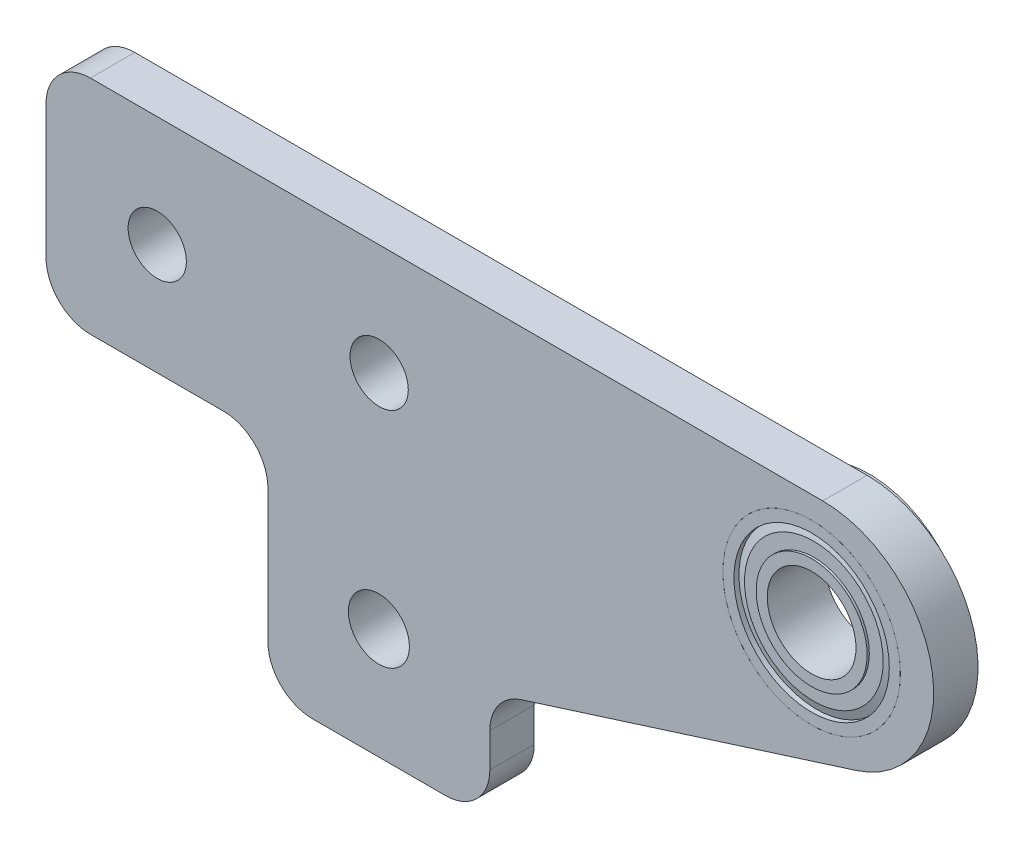
from build123d import *

# Parameters (mm, degrees)
SKETCH1_R           = 10
SKETCH1_R_2         = 8
BOSS_EXTRUDE1_DEPTH = 2
SKETCH2_R           = 2.75
SKETCH2_R_2         = 2.625
CUT_EXTRUDE1_DEPTH  = 76.345869163
FILLET1_R           = 4
SKETCH3_R           = 9
BOSS_EXTRUDE2_DEPTH = 1.2
SKETCH4_R           = 8
BOSS_EXTRUDE3_DEPTH = 4
SKETCH5_R           = 4
CUT_EXTRUDE2_DEPTH  = 76.419095725
SKETCH5_3_R         = 7
SKETCH5_3_R_2       = 5
CUT_EXTRUDE3_DEPTH  = 0.2


with BuildPart() as part:
    # Sketch1 → Boss-Extrude1 (new, symmetric)
    # profile 1 of 2: a face of its own
    with BuildSketch(Plane.XY):
        with BuildLine():
            ThreePointArc((4.021694793, -9.532542189), (-8.882444583, -1.528819498), (1, 10))
            Line((1, 10), (-69, 10))
            Line((-69, 10), (-69, -10))
            Line((-69, -10), (-49, -10))
            Line((-49, -10), (-49, -30))
            Line((-49, -30), (-29, -30))
            Line((-29, -30), (-29, -20))
            Line((-29, -20), (4.021694793, -9.532542189))
        make_face()
    # profile 2 of 2: a face of its own
    with BuildSketch(Plane.XY):
        with Locations((1, 0)):
            Circle(SKETCH1_R)
        Circle(SKETCH1_R_2, mode=Mode.SUBTRACT)
    extrude(amount=BOSS_EXTRUDE1_DEPTH, both=True)

    # Sketch2 → Cut-Extrude1 (cut, through all)
    with BuildSketch(Plane.XY.offset(2)):
        with Locations((-39, -20)):
            Circle(SKETCH2_R)
        with Locations((-58.975, 0)):
            Circle(SKETCH2_R_2)
        with Locations((-38.975, 0)):
            Circle(SKETCH2_R_2)
    extrude(amount=-CUT_EXTRUDE1_DEPTH, mode=Mode.SUBTRACT)

    # Fillet1
    fillet1_edges = [part.edges().sort_by_distance(p)[0] for p in [
        (-29, -20, 0),
        (-29, -30, 0),
        (-49, -30, 0),
        (-49, -10, 0),
        (-69, -10, 0),
        (-69, 10, 0),
    ]]
    fillet(fillet1_edges, radius=FILLET1_R)


with BuildPart() as body_2:
    # Sketch3 → Boss-Extrude2 (new body)
    with BuildSketch(Plane(origin=(0, 0, -2), x_dir=(-1, 0, 0), z_dir=(0, 0, -1))):
        Circle(SKETCH3_R)
    extrude(amount=BOSS_EXTRUDE2_DEPTH)

    # Sketch4 → Boss-Extrude3 (add)
    with BuildSketch(Plane.XY.offset(-2)):
        with Locations(Location((0, 0, 0), (0, 0, 180))):
            Circle(SKETCH4_R)
    extrude(amount=BOSS_EXTRUDE3_DEPTH)

    # Sketch5 → Cut-Extrude2 (cut, through all)
    with BuildSketch(Plane.XY.offset(2)):
        Circle(SKETCH5_R)
    extrude(amount=-CUT_EXTRUDE2_DEPTH, mode=Mode.SUBTRACT)

    # Sketch5<3> → Cut-Extrude3 (cut)
    with BuildSketch(Plane.XY.offset(2)):
        Circle(SKETCH5_3_R)
        Circle(SKETCH5_3_R_2, mode=Mode.SUBTRACT)
    cut_extrude3 = extrude(amount=-CUT_EXTRUDE3_DEPTH, mode=Mode.SUBTRACT)

    # Mirror8: Cut-Extrude3 across plane
    add(cut_extrude3.mirror(Plane.XY.offset(-0.6)), mode=Mode.SUBTRACT)

    # Sketch6 → Cut-Revolve1 (revolve, cut)
    with BuildSketch(Plane(origin=(0, 0, 0), x_dir=(0, 0, -1), z_dir=(1, 0, 0)), mode=Mode.PRIVATE) as cut_revolve1_sk:
        Polygon((-1.8, 6.25), (-1.55, 7), (-1.8, 7), align=None)
        Polygon((3, 6.25), (2.75, 7), (3, 7), align=None)
    revolve(cut_revolve1_sk.sketch.rotate(Axis((0, 0, 2), (0, 0, -1)), 90), axis=Axis((0, 0, 2), (0, 0, -1)), mode=Mode.SUBTRACT)


solid = Compound([part.part, body_2.part])
